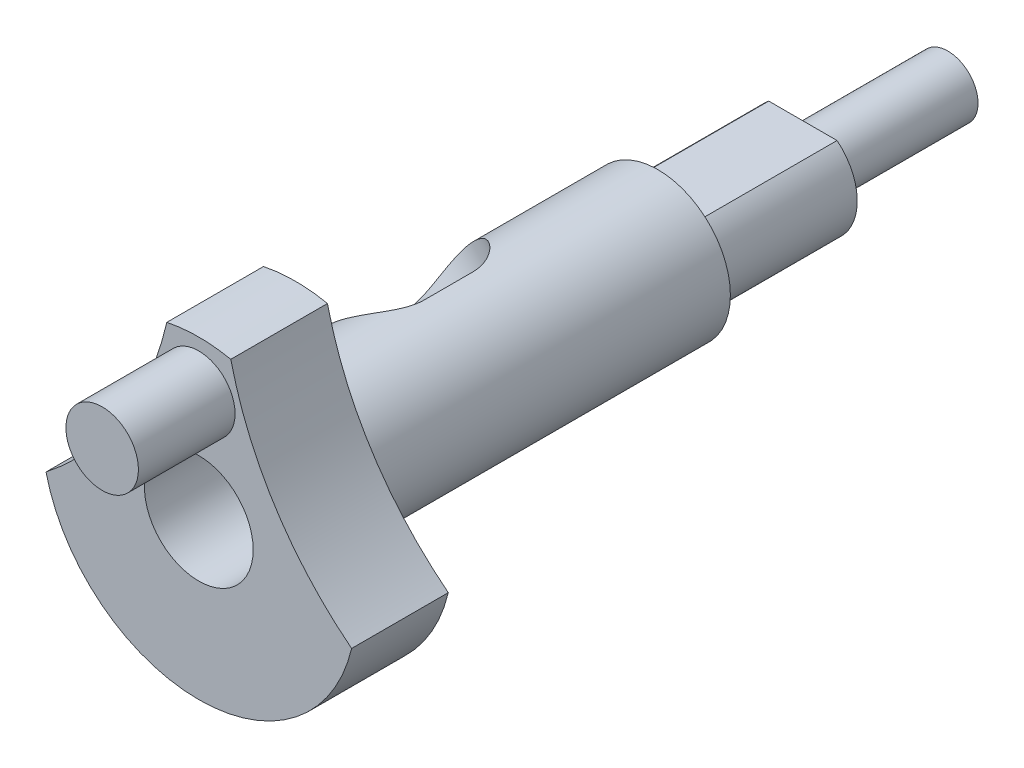
from build123d import *

# Parameters (mm, degrees)
SKETCH1_R           = 6
BOSS_EXTRUDE1_DEPTH = 38
SKETCH2_R           = 4.5
BOSS_EXTRUDE2_DEPTH = 12
BOSS_EXTRUDE3_DEPTH = 8
SKETCH4_R           = 3
BOSS_EXTRUDE4_DEPTH = 8
SKETCH5_R           = 4.5
CUT_EXTRUDE1_DEPTH  = 27
CUT_EXTRUDE2_DEPTH  = 5
SKETCH7_R           = 2.5
BOSS_EXTRUDE5_DEPTH = 12
SKETCH9_W           = 12
SKETCH9_H           = 1
CUT_EXTRUDE3_DEPTH  = 3.5


with BuildPart() as part:
    # Sketch1 → Boss-Extrude1 (new body)
    with BuildSketch(Plane.XY):
        Circle(SKETCH1_R)
    extrude(amount=BOSS_EXTRUDE1_DEPTH)

    # Sketch2 → Boss-Extrude2 (add)
    with BuildSketch(Plane(origin=(0, 0, 0), x_dir=(-1, 0, 0), z_dir=(0, 0, -1))):
        with Locations(Location((0, 0, 0), (0, 0, 180))):
            Circle(SKETCH2_R)
    extrude(amount=BOSS_EXTRUDE2_DEPTH)

    # Sketch3 → Boss-Extrude3 (add)
    with BuildSketch(Plane.XY.offset(38)):
        with BuildLine():
            ThreePointArc((-12.649110641, -3), (0, -13), (12.649110641, -3))
            ThreePointArc((12.649110641, -3), (6.302186147, 4.007182978), (2.649110641, 12.727223295))
            ThreePointArc((2.649110641, 12.727223295), (0, 13), (-2.649110641, 12.727223295))
            ThreePointArc((-2.649110641, 12.727223295), (-6.302186147, 4.007182978), (-12.649110641, -3))
        make_face()
    extrude(amount=-BOSS_EXTRUDE3_DEPTH)

    # Sketch4 → Boss-Extrude4 (add)
    with BuildSketch(Plane.XY.offset(38)):
        with Locations((0, 9)):
            Circle(SKETCH4_R)
    extrude(amount=BOSS_EXTRUDE4_DEPTH)

    # Sketch5 → Cut-Extrude1 (cut)
    with BuildSketch(Plane.XY.offset(38)):
        Circle(SKETCH5_R)
    extrude(amount=-CUT_EXTRUDE1_DEPTH, mode=Mode.SUBTRACT)

    # Sketch6 → Cut-Extrude2 (cut)
    with BuildSketch(Plane(origin=(-4.242640687, 4.242640687, 0), x_dir=(0, 0, -1), z_dir=(-0.7071067811865438, 0.7071067811865512, 0))):
        with BuildLine():
            Line((-19, 4), (-15, 4))
            ThreePointArc((-15, 4), (-11, 0), (-15, -4))
            Line((-15, -4), (-19, -4))
            ThreePointArc((-19, -4), (-23, 0), (-19, 4))
        make_face()
    extrude(amount=-CUT_EXTRUDE2_DEPTH, mode=Mode.SUBTRACT)

    # Sketch7 → Boss-Extrude5 (add)
    with BuildSketch(Plane(origin=(0, 0, -12), x_dir=(-1, 0, 0), z_dir=(0, 0, -1))):
        Circle(SKETCH7_R)
    extrude(amount=BOSS_EXTRUDE5_DEPTH)

    # Sketch9 → Cut-Extrude3 (cut, symmetric)
    with BuildSketch(Plane(origin=(0, 0, 0), x_dir=(0, 0, -1), z_dir=(1, 0, 0))):
        with Locations((6, 4)):
            Rectangle(SKETCH9_W, SKETCH9_H)
    extrude(amount=CUT_EXTRUDE3_DEPTH, both=True, mode=Mode.SUBTRACT)


solid = part.part
